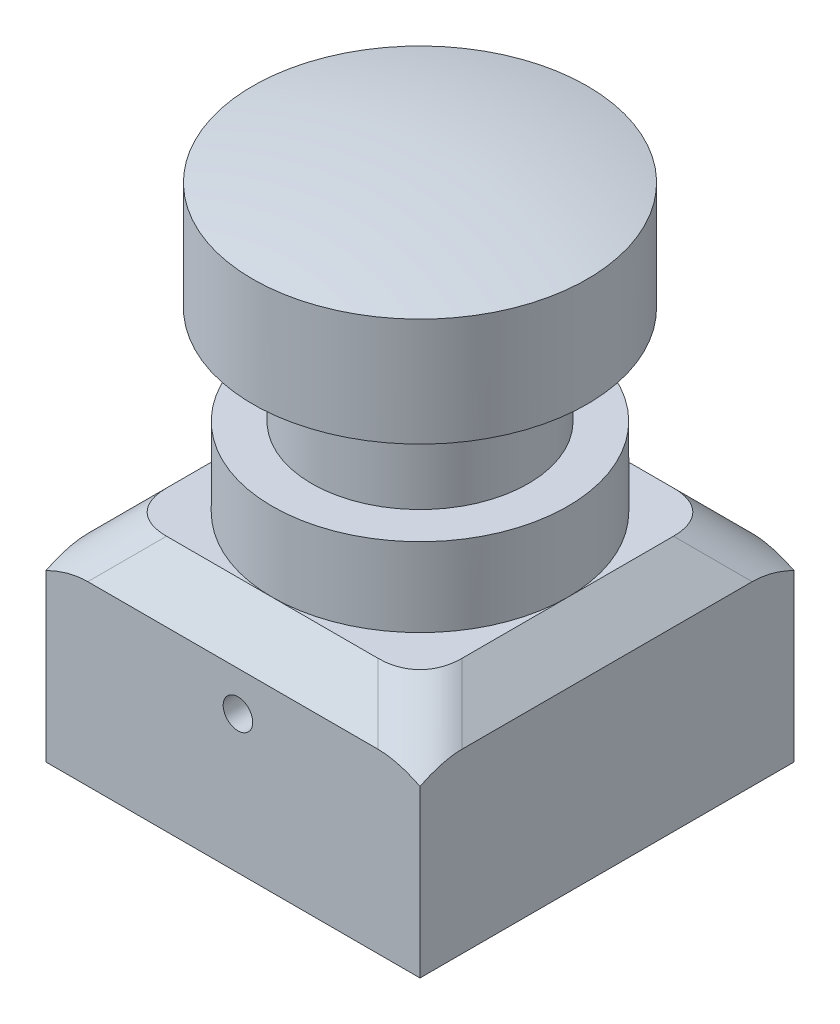
from build123d import *

# Parameters (mm, degrees)
SKETCH1_W           = 19
SKETCH1_H           = 19
BOSS_EXTRUDE1_DEPTH = 9
BOSS_EXTRUDE2_START = 9
SKETCH1_2_W         = 19
SKETCH1_2_H         = 19
BOSS_EXTRUDE2_DEPTH = 2
BOSS_EXTRUDE2_TAPER = 45
FILLET1_R           = 3
SKETCH2_R           = 7.5
BOSS_EXTRUDE3_DEPTH = 4
SKETCH3_R           = 5.5
BOSS_EXTRUDE4_DEPTH = 5
SKETCH4_R           = 8.5
BOSS_EXTRUDE5_DEPTH = 5.5
DOME1_FACE_RADIUS   = 8.5
DOME1_HEIGHT        = 1
SKETCH5_R           = 0.75
CUT_EXTRUDE1_DEPTH  = 5
CUT_EXTRUDE2_START  = -14
SKETCH5_2_R         = 0.75
CUT_EXTRUDE2_DEPTH  = 5


with BuildPart() as part:
    # Sketch1 → Boss-Extrude1 (new body)
    with BuildSketch(Plane(origin=(0, 0, 0), x_dir=(1, 0, 0), z_dir=(0, 1, 0))):
        with Locations((-1.648760331, 2.198347107)):
            Rectangle(SKETCH1_W, SKETCH1_H)
    extrude(amount=BOSS_EXTRUDE1_DEPTH)

    # Sketch1<2> → Boss-Extrude2 (add)
    with BuildSketch(Plane(origin=(0, 0, 0), x_dir=(1, 0, 0), z_dir=(0, 1, 0)).offset(BOSS_EXTRUDE2_START)):
        with Locations((-1.648760331, 2.198347107)):
            Rectangle(SKETCH1_2_W, SKETCH1_2_H)
    extrude(amount=BOSS_EXTRUDE2_DEPTH, taper=BOSS_EXTRUDE2_TAPER)

    # Fillet1
    fillet1_edges = [part.edges().sort_by_distance(p)[0] for p in [
        (6.851239669, 10, 6.301652893),
        (6.851239669, 10, -10.698347107),
        (-10.148760331, 10, -10.698347107),
        (-10.148760331, 10, 6.301652893),
    ]]
    fillet(fillet1_edges, radius=FILLET1_R)

    # Sketch2 → Boss-Extrude3 (add)
    with BuildSketch(Plane(origin=(0, 11, 0), x_dir=(1, 0, 0), z_dir=(0, 1, 0))):
        with Locations(Location((-1.648760331, 2.198347107, 0), (0, 0, 270))):
            Circle(SKETCH2_R)
    extrude(amount=BOSS_EXTRUDE3_DEPTH)

    # Sketch3 → Boss-Extrude4 (add)
    with BuildSketch(Plane(origin=(0, 15, 0), x_dir=(1, 0, 0), z_dir=(0, 1, 0))):
        with Locations(Location((-1.648760331, 2.198347107, 0), (0, 0, 270))):
            Circle(SKETCH3_R)
    extrude(amount=BOSS_EXTRUDE4_DEPTH)

    # Sketch4 → Boss-Extrude5 (add)
    with BuildSketch(Plane(origin=(0, 20, 0), x_dir=(1, 0, 0), z_dir=(0, 1, 0))):
        with Locations(Location((-1.648760331, 2.198347107, 0), (0, 0, 90))):
            Circle(SKETCH4_R)
    extrude(amount=BOSS_EXTRUDE5_DEPTH)

    # Dome1: a dome of height H over a round flat face of radius A is a cap of a sphere of radius (A * A + H * H) / (2 * H)
    dome1_r = (DOME1_FACE_RADIUS * DOME1_FACE_RADIUS + DOME1_HEIGHT * DOME1_HEIGHT) / (2 * DOME1_HEIGHT)
    dome1_base = Plane((-1.648760331, 25.5, -2.198347107), z_dir=(0, 1, 0))
    with Locations(dome1_base.offset(DOME1_HEIGHT - dome1_r)):
        dome1_ball = Sphere(dome1_r, mode=Mode.PRIVATE)
    add(split(dome1_ball, bisect_by=dome1_base, keep=Keep.TOP, mode=Mode.PRIVATE))

    # Sketch5 → Cut-Extrude1 (cut)
    with BuildSketch(Plane.XY.offset(7.301652893)):
        with Locations((-1.398760331, 7)):
            Circle(SKETCH5_R)
    extrude(amount=-CUT_EXTRUDE1_DEPTH, mode=Mode.SUBTRACT)

    # Sketch5<2> → Cut-Extrude2 (cut)
    with BuildSketch(Plane.XY.offset(7.301652893).offset(CUT_EXTRUDE2_START)):
        with Locations((-1.398760331, 7)):
            Circle(SKETCH5_2_R)
    extrude(amount=-CUT_EXTRUDE2_DEPTH, mode=Mode.SUBTRACT)


solid = part.part
